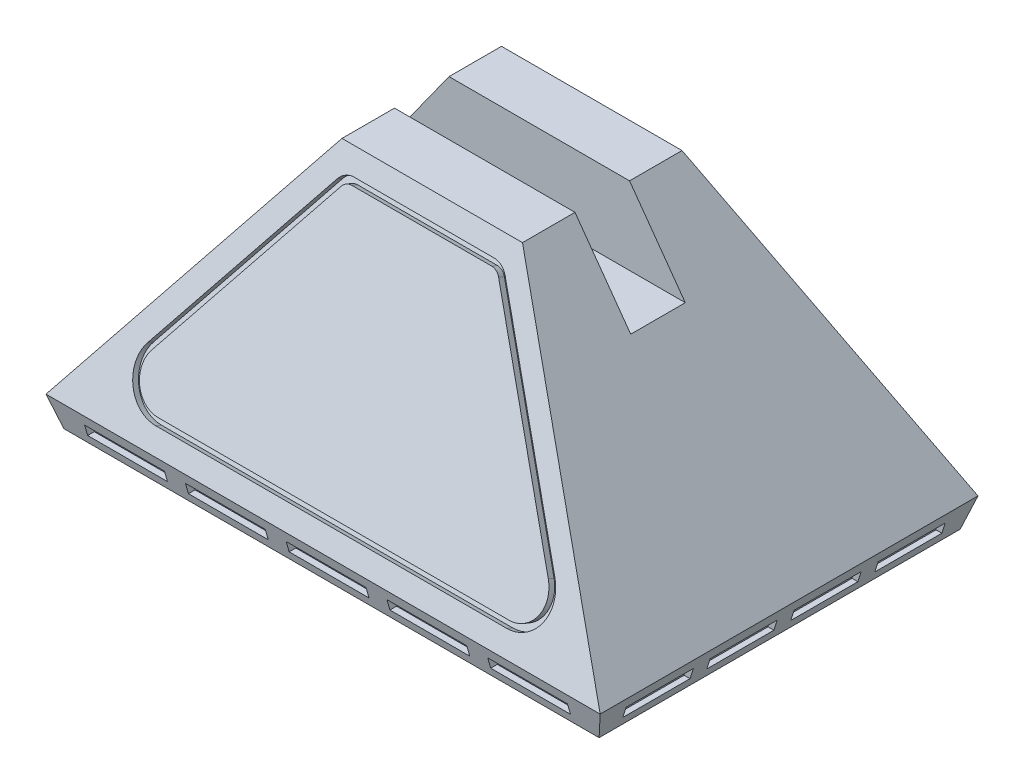
from build123d import *

# Parameters (mm, degrees)
CUT_EXTRUDE_1_DEPTH      = 214.084490455
CUT_EXTRUDE_1_DEPTH_BACK = 214.084490455
SKETCH_6_W               = 26
SKETCH_6_H               = 37
SKETCH_7_W               = 32
SKETCH_7_H               = 5
CUT_EXTRUDE_2_DEPTH      = 6
SKETCH_8_W               = 38
SKETCH_8_H               = 5
CUT_EXTRUDE_3_DEPTH      = 6
CUT_EXTRUDE_4_DEPTH      = 3


with BuildPart() as part:
    # Эскиз1 → По сечениям1 section 0
    with BuildSketch(Plane(origin=(0, 0, 0), x_dir=(1, 0, 0), z_dir=(0, 1, 0))):
        with BuildLine():
            Line((-123.5, -81.5), (123.5, -81.5))
            Line((123.5, -81.5), (123.5, 81.5))
            Line((123.5, 81.5), (-123.5, 81.5))
            Line((-123.5, 81.5), (-123.5, -81.5))
        make_face()
    # Эскиз2 → По сечениям1 section 1
    with BuildSketch(Plane(origin=(0, 3, 0), x_dir=(1, 0, 0), z_dir=(0, 1, 0))):
        with BuildLine():
            Line((-124.5, -82.5), (124.5, -82.5))
            Line((124.5, -82.5), (124.5, 82.5))
            Line((124.5, 82.5), (-124.5, 82.5))
            Line((-124.5, 82.5), (-124.5, -82.5))
        make_face()
    loft()

    # Эскиз3 → По сечениям2 section 0
    with BuildSketch(Plane(origin=(0, 3, 0), x_dir=(1, 0, 0), z_dir=(0, 1, 0))):
        with BuildLine():
            Line((-127.5, -86), (127.5, -86))
            Line((127.5, -86), (127.5, 86))
            Line((127.5, 86), (-127.5, 86))
            Line((-127.5, 86), (-127.5, -86))
        make_face()
    # Эскиз4 → По сечениям2 section 1
    with BuildSketch(Plane(origin=(0, 17, 0), x_dir=(1, 0, 0), z_dir=(0, 1, 0))):
        with BuildLine():
            Line((-132, -90), (132, -90))
            Line((132, -90), (132, 90))
            Line((132, 90), (-132, 90))
            Line((-132, 90), (-132, -90))
        make_face()
    loft()

    # Эскиз5 → section 1 of loft_3
    with BuildSketch(Plane(origin=(0, 141, 0), x_dir=(1, 0, 0), z_dir=(0, 1, 0)), mode=Mode.PRIVATE) as loft_3_s1:
        with BuildLine():
            Line((-43, -38), (43, -38))
            Line((43, -38), (43, 38))
            Line((43, 38), (-43, 38))
            Line((-43, 38), (-43, -38))
        make_face()
    # loft from a face of the part (loft_3)
    loft([part.faces().sort_by_distance((0, 17, 0))[0], loft_3_s1.sketch])

    # Эскиз6 → Вырез-Вытянуть1 (cut, two sides: drawn at the far end of the back side and taken through both)
    with BuildSketch(Plane(origin=(0, 0, 0), x_dir=(0, 0, -1), z_dir=(1, 0, 0)).offset(-CUT_EXTRUDE_1_DEPTH_BACK)):
        with Locations((0, 122.5)):
            Rectangle(SKETCH_6_W, SKETCH_6_H)
    extrude(amount=CUT_EXTRUDE_1_DEPTH + CUT_EXTRUDE_1_DEPTH_BACK, mode=Mode.SUBTRACT)

    # Эскиз7 → Вырез-Вытянуть2 (cut)
    with BuildSketch(Plane(origin=(132, 0, 0), x_dir=(0, 0, -1), z_dir=(1, 0, 0))):
        with Locations((-20, 9.5)):
            Rectangle(SKETCH_7_W, SKETCH_7_H)
        with Locations((-60, 9.5)):
            Rectangle(SKETCH_7_W, SKETCH_7_H)
        with Locations((60, 9.5)):
            Rectangle(SKETCH_7_W, SKETCH_7_H)
        with Locations((20, 9.5)):
            Rectangle(SKETCH_7_W, SKETCH_7_H)
    cut_extrude_2 = extrude(amount=-CUT_EXTRUDE_2_DEPTH, mode=Mode.SUBTRACT)

    # Зеркальное отражение1: Вырез-Вытянуть2 across plane
    add(cut_extrude_2.mirror(Plane(origin=(0, 0, 0), x_dir=(0, 0, 1), z_dir=(1, 0, 0))), mode=Mode.SUBTRACT)

    # Эскиз8 → Вырез-Вытянуть3 (cut)
    with BuildSketch(Plane.XY.offset(90)):
        with Locations((-96, 9.5)):
            Rectangle(SKETCH_8_W, SKETCH_8_H)
        with Locations((-48, 9.5)):
            Rectangle(SKETCH_8_W, SKETCH_8_H)
        with Locations((0, 9.5)):
            Rectangle(SKETCH_8_W, SKETCH_8_H)
        with Locations((48, 9.5)):
            Rectangle(SKETCH_8_W, SKETCH_8_H)
        with Locations((96, 9.5)):
            Rectangle(SKETCH_8_W, SKETCH_8_H)
    cut_extrude_3 = extrude(amount=-CUT_EXTRUDE_3_DEPTH, mode=Mode.SUBTRACT)

    # Зеркальное отражение2: Вырез-Вытянуть3 across plane
    add(cut_extrude_3.mirror(Plane.XY), mode=Mode.SUBTRACT)

    # Эскиз9 → Вырез-Вытянуть4 (cut)
    with BuildSketch(Plane(origin=(0, 34.639823009, 82.602654867), x_dir=(1, 0, 0), z_dir=(0, 0.38672667625067414, 0.922194381828531))):
        with BuildLine():
            Line((96.953261243, 15.703006904), (39.999397731, 101.749345778))
            ThreePointArc((39.999397731, 101.749345778), (37.114875946, 104.380935869), (33.328348058, 105.33379414))
            Line((33.328348058, 105.33379414), (-33.328348058, 105.33379414))
            ThreePointArc((-33.328348058, 105.33379414), (-37.114875946, 104.380935869), (-39.999397731, 101.749345778))
            Line((-39.999397731, 101.749345778), (-96.953261243, 15.703006904))
            ThreePointArc((-96.953261243, 15.703006904), (-97.705445356, -0.701152148), (-83.611161898, -9.128096371))
            Line((-83.611161898, -9.128096371), (83.611161898, -9.128096371))
            ThreePointArc((83.611161898, -9.128096371), (97.705445356, -0.701152148), (96.953261243, 15.703006904))
        make_face()
        with BuildLine():
            Line((-37.497754103, 100.093513914), (-94.451617616, 14.04717504))
            ThreePointArc((-94.451617616, 14.04717504), (-95.062767207, 0.71879581), (-83.611161898, -6.128096371))
            Line((-83.611161898, -6.128096371), (83.611161898, -6.128096371))
            ThreePointArc((83.611161898, -6.128096371), (95.062767207, 0.71879581), (94.451617616, 14.04717504))
            Line((94.451617616, 14.04717504), (37.497754103, 100.093513914))
            ThreePointArc((37.497754103, 100.093513914), (35.694927988, 101.738257721), (33.328348058, 102.33379414))
            Line((33.328348058, 102.33379414), (-33.328348058, 102.33379414))
            ThreePointArc((-33.328348058, 102.33379414), (-35.694927988, 101.738257721), (-37.497754103, 100.093513914))
        make_face(mode=Mode.SUBTRACT)
    cut_extrude_4 = extrude(amount=-CUT_EXTRUDE_4_DEPTH, mode=Mode.SUBTRACT)

    # Зеркальное отражение3: Вырез-Вытянуть4 across plane
    add(cut_extrude_4.mirror(Plane.XY), mode=Mode.SUBTRACT)


solid = part.part
